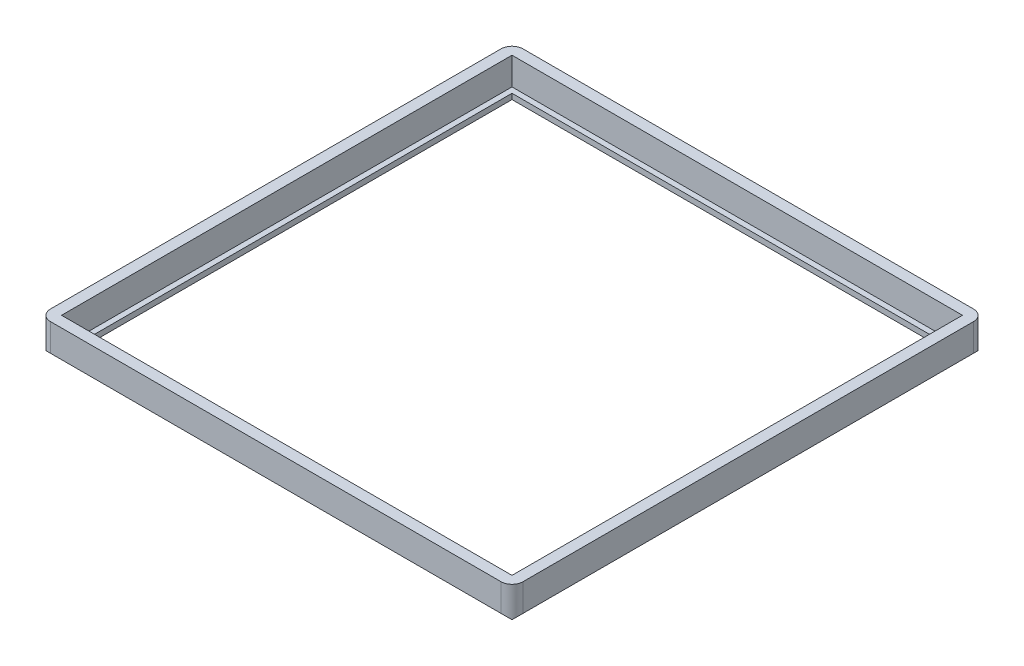
from build123d import *

# Parameters (mm, degrees)
SKETCH_1_W          = 86
SKETCH_1_H          = 86
EXTRUDE_1_DEPTH     = 1
SKETCH_2_W          = 80
SKETCH_2_H          = 80
CUT_EXTRUDE_1_DEPTH = 61.819404798
SKETCH_3_W          = 86
SKETCH_3_H          = 86
SKETCH_3_W_2        = 82
SKETCH_3_H_2        = 82
EXTRUDE_2_DEPTH     = 5
CHAMFER_1_SIZE      = 1
FILLET_1_R          = 2


with BuildPart() as part:
    # 草图1 → 凸台-拉伸1 (new body)
    with BuildSketch(Plane(origin=(0, 0, 0), x_dir=(1, 0, 0), z_dir=(0, 1, 0))):
        Rectangle(SKETCH_1_W, SKETCH_1_H)
    extrude(amount=EXTRUDE_1_DEPTH)

    # 草图2 → 切除-拉伸1 (cut, through all)
    with BuildSketch(Plane.XZ):
        Rectangle(SKETCH_2_W, SKETCH_2_H)
    extrude(amount=-CUT_EXTRUDE_1_DEPTH, mode=Mode.SUBTRACT)

    # 草图3 → 凸台-拉伸2 (add)
    with BuildSketch(Plane(origin=(0, 1, 0), x_dir=(1, 0, 0), z_dir=(0, 1, 0))):
        Rectangle(SKETCH_3_W, SKETCH_3_H)
        Rectangle(SKETCH_3_W_2, SKETCH_3_H_2, mode=Mode.SUBTRACT)
    extrude(amount=EXTRUDE_2_DEPTH)

    # 倒角1
    chamfer_1_edges = [part.edges().sort_by_distance(p)[0] for p in [
        (0, 0, 43),
        (43, 0, 0),
        (0, 0, -43),
        (-43, 0, 0),
    ]]
    chamfer(chamfer_1_edges, length=CHAMFER_1_SIZE)

    # 圆角1
    fillet_1_edges = [part.edges().sort_by_distance(p)[0] for p in [
        (-43, 3.5, 43),
        (43, 3.5, 43),
        (43, 3.5, -43),
        (-43, 3.5, -43),
    ]]
    fillet(fillet_1_edges, radius=FILLET_1_R)


solid = part.part
